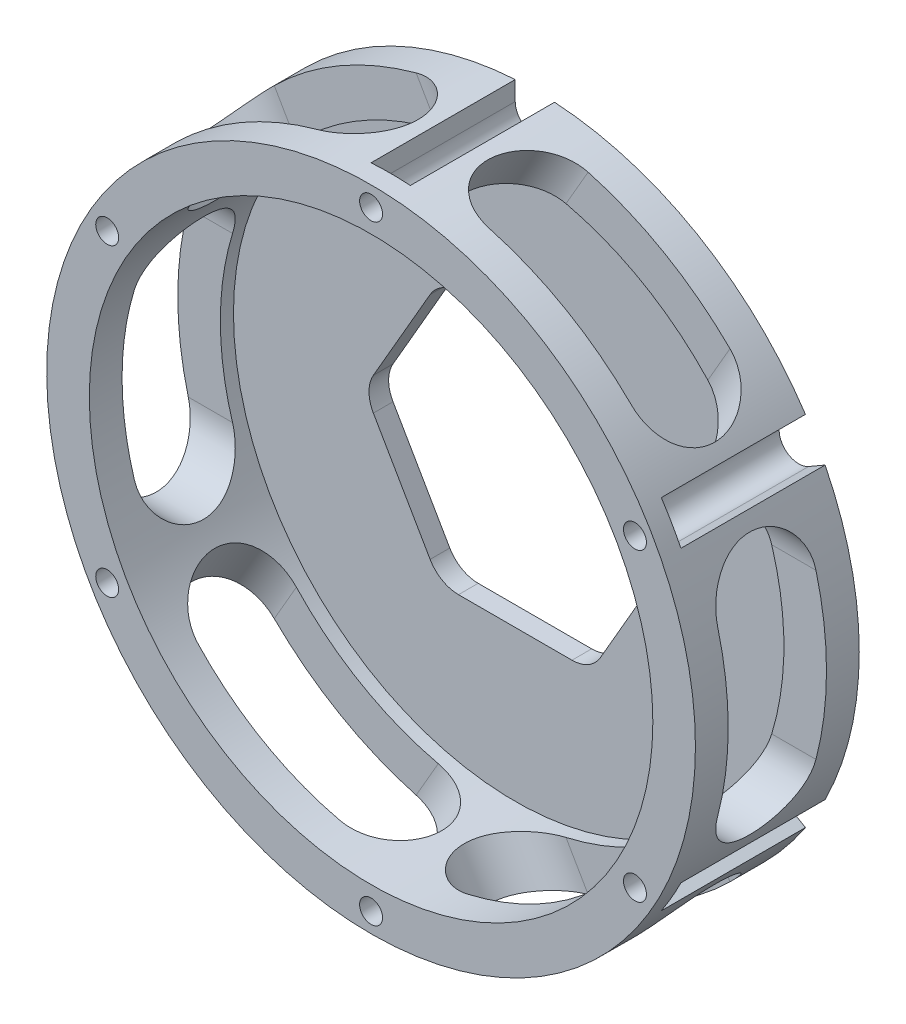
from build123d import *

# Parameters (mm, degrees)
SKETCH_1_R               = 49.5
SKETCH_1_R_2             = 43
SKETCH_1_R_3             = 1.75
EXTRUDE_1_DEPTH          = 25
CUT_EXTRUDE_1_DEPTH      = 59
PATTERN_CIRCULAR_1_COUNT = 6
SKETCH_3_R               = 44.045845484
EXTRUDE_2_DEPTH          = 3
CUT_EXTRUDE_3_DEPTH      = 22
CUT_EXTRUDE_4_DEPTH      = 10


with BuildPart() as part:
    # Эскиз1 → Бобышка-Вытянуть1 (new body)
    with BuildSketch(Plane.XY):
        Circle(SKETCH_1_R)
        Circle(SKETCH_1_R_2, mode=Mode.SUBTRACT)
        with Locations((0, 46.5)):
            Circle(SKETCH_1_R_3, mode=Mode.SUBTRACT)
        with Locations((40.270181276, 23.25)):
            Circle(SKETCH_1_R_3, mode=Mode.SUBTRACT)
        with Locations((40.270181276, -23.25)):
            Circle(SKETCH_1_R_3, mode=Mode.SUBTRACT)
        with Locations((0, -46.5)):
            Circle(SKETCH_1_R_3, mode=Mode.SUBTRACT)
        with Locations((-40.270181276, -23.25)):
            Circle(SKETCH_1_R_3, mode=Mode.SUBTRACT)
        with Locations((-40.270181276, 23.25)):
            Circle(SKETCH_1_R_3, mode=Mode.SUBTRACT)
    extrude(amount=EXTRUDE_1_DEPTH)

    # Эскиз2 → Вырез-Вытянуть1 (cut)
    with BuildSketch(Plane(origin=(0, 0, 0), x_dir=(0, 0, -1), z_dir=(1, 0, 0))):
        with BuildLine():
            Line((-5, 12.5), (-5, -12.5))
            ThreePointArc((-5, -12.5), (-12.5, -20), (-20, -12.5))
            Line((-20, -12.5), (-20, 12.5))
            ThreePointArc((-20, 12.5), (-12.5, 20), (-5, 12.5))
        make_face()
    cut_extrude_1 = extrude(amount=-CUT_EXTRUDE_1_DEPTH, mode=Mode.SUBTRACT)

    # Круговой массив1: Вырез-Вытянуть1 ×6 about axis
    pattern_circular_1_axis = Axis((0, 0, 25), (0, 0, -1))
    for i in range(1, PATTERN_CIRCULAR_1_COUNT):
        add(cut_extrude_1.rotate(pattern_circular_1_axis, i * 360 / PATTERN_CIRCULAR_1_COUNT), mode=Mode.SUBTRACT)

    # Эскиз3 → Бобышка-Вытянуть2 (add)
    with BuildSketch(Plane(origin=(0, 0, 0), x_dir=(-1, 0, 0), z_dir=(0, 0, -1))):
        Circle(SKETCH_3_R)
    extrude(amount=-EXTRUDE_2_DEPTH)

    # Эскиз4 → Вырез-Вытянуть3 (cut)
    with BuildSketch(Plane(origin=(0, 0, 0), x_dir=(-1, 0, 0), z_dir=(0, 0, -1))):
        with BuildLine():
            Line((-3, 46.5), (-3, 53.502718932))
            ThreePointArc((-3, 53.502718932), (0, 56.502718932), (3, 53.502718932))
            Line((3, 53.502718932), (3, 46.5))
            ThreePointArc((3, 46.5), (0, 43.5), (-3, 46.5))
        make_face()
        with BuildLine():
            Line((-41.770181276, 20.651923789), (-47.834713767, 24.153283255))
            ThreePointArc((-47.834713767, 24.153283255), (-48.932789978, 28.251359466), (-44.834713767, 29.349435677))
            Line((-44.834713767, 29.349435677), (-38.770181276, 25.848076211))
            ThreePointArc((-38.770181276, 25.848076211), (-37.672105065, 21.75), (-41.770181276, 20.651923789))
        make_face()
        with BuildLine():
            Line((-38.770181276, -25.848076211), (-44.834713767, -29.349435677))
            ThreePointArc((-44.834713767, -29.349435677), (-48.932789978, -28.251359466), (-47.834713767, -24.153283255))
            Line((-47.834713767, -24.153283255), (-41.770181276, -20.651923789))
            ThreePointArc((-41.770181276, -20.651923789), (-37.672105065, -21.75), (-38.770181276, -25.848076211))
        make_face()
        with BuildLine():
            Line((3, -46.5), (3, -53.502718932))
            ThreePointArc((3, -53.502718932), (0, -56.502718932), (-3, -53.502718932))
            Line((-3, -53.502718932), (-3, -46.5))
            ThreePointArc((-3, -46.5), (0, -43.5), (3, -46.5))
        make_face()
        with BuildLine():
            Line((41.770181276, -20.651923789), (47.834713767, -24.153283255))
            ThreePointArc((47.834713767, -24.153283255), (48.932789978, -28.251359466), (44.834713767, -29.349435677))
            Line((44.834713767, -29.349435677), (38.770181276, -25.848076211))
            ThreePointArc((38.770181276, -25.848076211), (37.672105065, -21.75), (41.770181276, -20.651923789))
        make_face()
        with BuildLine():
            Line((38.770181276, 25.848076211), (44.834713767, 29.349435677))
            ThreePointArc((44.834713767, 29.349435677), (48.932789978, 28.251359466), (47.834713767, 24.153283255))
            Line((47.834713767, 24.153283255), (41.770181276, 20.651923789))
            ThreePointArc((41.770181276, 20.651923789), (37.672105065, 21.75), (38.770181276, 25.848076211))
        make_face()
    extrude(amount=-CUT_EXTRUDE_3_DEPTH, mode=Mode.SUBTRACT)

    # Эскиз5 → Вырез-Вытянуть4 (cut)
    with BuildSketch(Plane(origin=(0, 0, 0), x_dir=(-1, 0, 0), z_dir=(0, 0, -1))):
        with BuildLine():
            Line((8.660254038, 20), (-8.660254038, 20))
            ThreePointArc((-8.660254038, 20), (-11.160254038, 19.330127019), (-12.990381057, 17.5))
            Line((-12.990381057, 17.5), (-21.650635095, 2.5))
            ThreePointArc((-21.650635095, 2.5), (-22.320508076, 0), (-21.650635095, -2.5))
            Line((-21.650635095, -2.5), (-12.990381057, -17.5))
            ThreePointArc((-12.990381057, -17.5), (-11.160254038, -19.330127019), (-8.660254038, -20))
            Line((-8.660254038, -20), (8.660254038, -20))
            ThreePointArc((8.660254038, -20), (11.160254038, -19.330127019), (12.990381057, -17.5))
            Line((12.990381057, -17.5), (21.650635095, -2.5))
            ThreePointArc((21.650635095, -2.5), (22.320508076, 0), (21.650635095, 2.5))
            Line((21.650635095, 2.5), (12.990381057, 17.5))
            ThreePointArc((12.990381057, 17.5), (11.160254038, 19.330127019), (8.660254038, 20))
        make_face()
    extrude(amount=-CUT_EXTRUDE_4_DEPTH, mode=Mode.SUBTRACT)


solid = part.part
